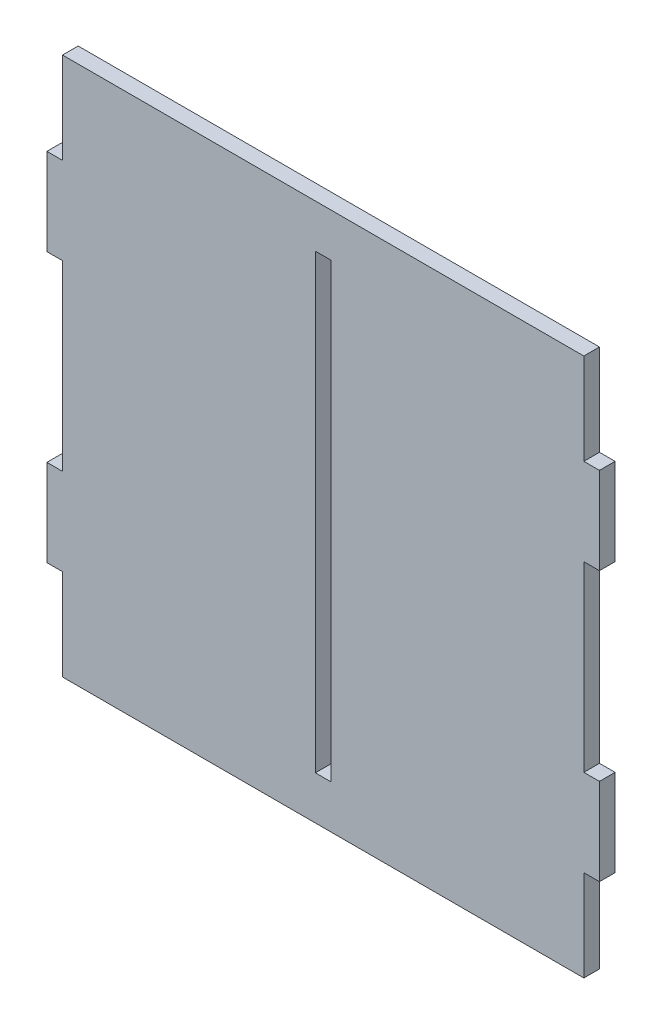
from build123d import *

# Parameters (mm, degrees)
BOSS_EXTRUDE3_DEPTH     = 18
CUT_EXTRUDE1_DEPTH      = 876.584376288
CUT_EXTRUDE1_DEPTH_BACK = 876.584376288
SKETCH2_W               = 18
SKETCH2_H               = 520


with BuildPart() as part:
    # Sketch1 → Boss-Extrude3 (new body)
    with BuildSketch(Plane.XY):
        Polygon((0, 0), (0, -105), (-18, -105), (-18, -205), (0, -205), (0, -415), (-18, -415), (-18, -515), (0, -515), (0, -620), (600, -620), (600, -515), (618, -515), (618, -415), (600, -415), (600, -205), (618, -205), (618, -105), (600, -105), (600, 0), align=None)
    extrude(amount=BOSS_EXTRUDE3_DEPTH)

    # Sketch2 → Cut-Extrude1 (cut, two sides: drawn at the far end of the back side and taken through both)
    with BuildSketch(Plane(origin=(0, 0, 0), x_dir=(-1, 0, 0), z_dir=(0, 0, -1)).offset(-CUT_EXTRUDE1_DEPTH_BACK)):
        with Locations((-300, -310)):
            Rectangle(SKETCH2_W, SKETCH2_H)
    extrude(amount=CUT_EXTRUDE1_DEPTH + CUT_EXTRUDE1_DEPTH_BACK, mode=Mode.SUBTRACT)


solid = part.part
